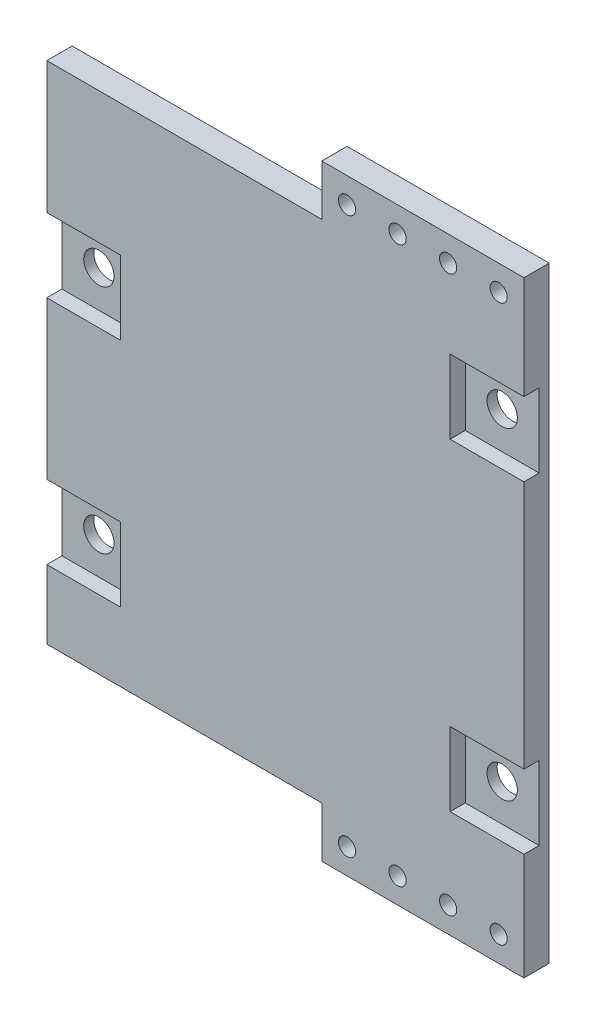
from build123d import *

# Parameters (mm, degrees)
SKETCH2_W           = 92
SKETCH2_H           = 100
SKETCH2_R           = 3
SKETCH2_W_2         = 2.4
BOSS_EXTRUDE1_DEPTH = 2
BOSS_EXTRUDE3_DEPTH = 3
SKETCH5_W           = 40
SKETCH5_H           = 10
SKETCH5_R           = 1.7
BOSS_EXTRUDE4_DEPTH = 5


with BuildPart() as part:
    # Sketch2 → Boss-Extrude1 (new body)
    # profile 1 of 2: a face of its own
    with BuildSketch(Plane.XY):
        with Locations((113.934873736, 68.240270394)):
            Rectangle(SKETCH2_W, SKETCH2_H)
        with Locations((75.234873736, 39.180270394)):
            Circle(SKETCH2_R, mode=Mode.SUBTRACT)
        with Locations((155.034873736, 36.740270394)):
            Circle(SKETCH2_R, mode=Mode.SUBTRACT)
        with Locations((75.234873736, 84.900270394)):
            Circle(SKETCH2_R, mode=Mode.SUBTRACT)
        with Locations((155.034873736, 100.560270394)):
            Circle(SKETCH2_R, mode=Mode.SUBTRACT)
    # profile 2 of 2: a face of its own
    with BuildSketch(Plane.XY):
        with Locations((161.134873736, 68.240270394)):
            Rectangle(SKETCH2_W_2, SKETCH2_H)
    extrude(amount=BOSS_EXTRUDE1_DEPTH)

    # Sketch3 → Boss-Extrude3 (add)
    with BuildSketch(Plane.XY.offset(2)):
        Polygon((82.534873736, 77.600270394), (67.934873736, 77.600270394), (67.934873736, 46.480270394), (82.534873736, 46.480270394), (82.534873736, 31.880270394), (67.934873736, 31.880270394), (67.934873736, 18.240270394), (162.334873736, 18.240270394), (162.334873736, 29.440270394), (147.734873736, 29.440270394), (147.734873736, 44.040270394), (162.334873736, 44.040270394), (162.334873736, 93.260270394), (147.734873736, 93.260270394), (147.734873736, 107.860270394), (162.334873736, 107.860270394), (162.334873736, 118.240270394), (67.934873736, 118.240270394), (67.934873736, 92.200270394), (82.534873736, 92.200270394), align=None)
    extrude(amount=BOSS_EXTRUDE3_DEPTH)

    # Sketch5 → Boss-Extrude4 (add)
    # profile 1 of 2: a face of its own
    with BuildSketch(Plane(origin=(0, 0, 0), x_dir=(-1, 0, 0), z_dir=(0, 0, -1))):
        with Locations((-142.334873736, 123.240270394)):
            Rectangle(SKETCH5_W, SKETCH5_H)
        with Locations((-157.334873736, 123.240270394)):
            Circle(SKETCH5_R, mode=Mode.SUBTRACT)
        with Locations((-147.334873736, 123.240270394)):
            Circle(SKETCH5_R, mode=Mode.SUBTRACT)
        with Locations((-137.334873736, 123.240270394)):
            Circle(SKETCH5_R, mode=Mode.SUBTRACT)
        with Locations((-127.334873736, 123.240270394)):
            Circle(SKETCH5_R, mode=Mode.SUBTRACT)
    # profile 2 of 2: a face of its own
    with BuildSketch(Plane(origin=(0, 0, 0), x_dir=(-1, 0, 0), z_dir=(0, 0, -1))):
        with Locations((-142.334873736, 13.240270394)):
            Rectangle(SKETCH5_W, SKETCH5_H)
        with Locations((-157.334873736, 13.240270394)):
            Circle(SKETCH5_R, mode=Mode.SUBTRACT)
        with Locations((-147.334873736, 13.240270394)):
            Circle(SKETCH5_R, mode=Mode.SUBTRACT)
        with Locations((-137.334873736, 13.240270394)):
            Circle(SKETCH5_R, mode=Mode.SUBTRACT)
        with Locations((-127.334873736, 13.240270394)):
            Circle(SKETCH5_R, mode=Mode.SUBTRACT)
    extrude(amount=-BOSS_EXTRUDE4_DEPTH)


solid = part.part
